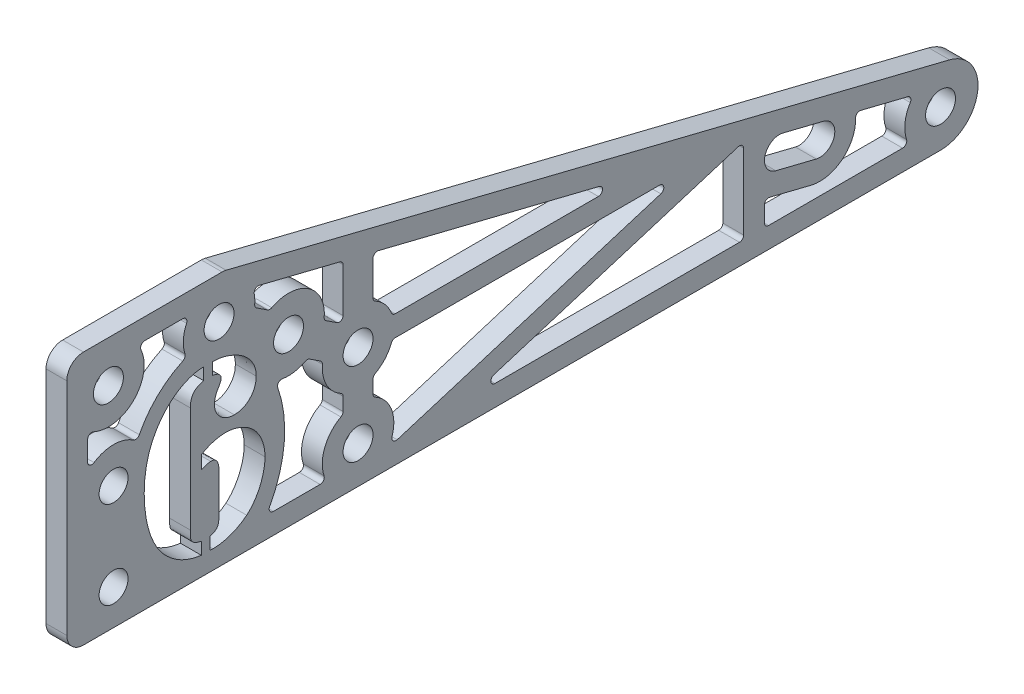
from build123d import *

# Parameters (mm, degrees)
SKETCH1_R           = 2.286
BOSS_EXTRUDE1_DEPTH = 3.175
SKETCH2_R           = 2.20991013
CUT_EXTRUDE1_DEPTH  = 99.353280322
CUT_EXTRUDE2_DEPTH  = 99.353280322
CUT_EXTRUDE3_DEPTH  = 99.353280448


with BuildPart() as part:
    # Sketch1 → Boss-Extrude1 (new body)
    with BuildSketch(Plane(origin=(0, 0, 0), x_dir=(0, 0, -1), z_dir=(1, 0, 0))):
        with BuildLine():
            Line((-20.135783276, 26.595233027), (90.276415546, -0.80322569))
            ThreePointArc((90.276415546, -0.80322569), (94.572787682, -7.043328861), (88.9, -12.065))
            Line((88.9, -12.065), (0, -12.065))
            Line((0, -12.065), (-41.91, -12.065))
            ThreePointArc((-41.91, -12.065), (-43.706051224, -11.321051224), (-44.45, -9.525))
            Line((-44.45, -9.525), (-44.45, 24.13))
            ThreePointArc((-44.45, 24.13), (-43.706051224, 25.926051224), (-41.91, 26.67))
            Line((-41.91, 26.67), (-20.747523518, 26.67))
            ThreePointArc((-20.747523518, 26.67), (-20.439377358, 26.65123897), (-20.135783276, 26.595233027))
        make_face()
        with Locations((0, 6.35)):
            Circle(SKETCH1_R, mode=Mode.SUBTRACT)
        with Locations((0, -6.35)):
            Circle(SKETCH1_R, mode=Mode.SUBTRACT)
        with Locations((88.9, -6.35)):
            Circle(SKETCH1_R, mode=Mode.SUBTRACT)
        with Locations((-21.213182222, 20.32)):
            Circle(SKETCH1_R, mode=Mode.SUBTRACT)
        with Locations((-10.606591111, 13.335)):
            Circle(SKETCH1_R, mode=Mode.SUBTRACT)
        with Locations((-38.1, 20.32)):
            Circle(SKETCH1_R, mode=Mode.SUBTRACT)
    extrude(amount=BOSS_EXTRUDE1_DEPTH)

    # Sketch2 → Cut-Extrude1 (cut, through all)
    with BuildSketch(Plane(origin=(3.175, 0, 0), x_dir=(0, 0, -1), z_dir=(1, 0, 0))):
        with Locations((-37.310316922, 6.68008987)):
            Circle(SKETCH2_R)
        with Locations((-37.310316922, -6.68008987)):
            Circle(SKETCH2_R)
        with BuildLine():
            Line((64.861053538, 2.232227609), (71.024136105, 0.702877002))
            ThreePointArc((71.024136105, 0.702877002), (72.69227961, -2.06639894), (69.923003668, -3.734542446))
            Line((69.923003668, -3.734542446), (63.759921102, -2.205191839))
            ThreePointArc((63.759921102, -2.205191839), (62.091777596, 0.564084103), (64.861053538, 2.232227609))
        make_face()
    extrude(amount=-CUT_EXTRUDE1_DEPTH, mode=Mode.SUBTRACT)

    # Sketch3 → Cut-Extrude2 (cut, through all)
    with BuildSketch(Plane(origin=(3.175, 0, 0), x_dir=(0, 0, -1), z_dir=(1, 0, 0))):
        with BuildLine():
            Line((-23.589615802, 15.538483073), (-23.589615802, 13.731875))
            add(Edge.make_bspline(
                [(-23.589615802, 13.731875), (-23.758611217, 13.678210567), (-24.077268221, 13.577021151), (-24.510457914, 13.372609717), (-24.866181573, 13.126522501), (-25.151110457, 12.837721592), (-25.354073316, 12.490606569), (-25.502400912, 12.09276775), (-25.581902611, 11.629848452), (-25.594035845, 11.302394911), (-25.600449135, 11.129312066)],
                knots=[0, 0, 0, 0, 1.177836724, 2.220923683, 3.170508287, 4.04032801, 4.893978525, 5.822851288, 6.849219673, 8, 8, 8, 8], degree=3))
            Line((-25.600449135, 11.129312066), (-25.600449135, -5.020193142))
            add(Edge.make_bspline(
                [(-25.600449135, -5.020193142), (-25.59897276, -5.149358853), (-25.596258891, -5.386790891), (-25.588810183, -5.711801227), (-25.567152347, -5.972099442), (-25.537820037, -6.230012219), (-25.449384558, -6.504947834), (-25.309832818, -6.67338549), (-25.23912752, -6.758726128)],
                knots=[0, 0, 0, 0, 1.276365713, 2.34621177, 3.211297358, 3.855222149, 4.913326661, 6, 6, 6, 6], degree=3))
            add(Edge.make_bspline(
                [(-25.23912752, -6.758726128), (-25.171800829, -6.821594977), (-25.024733704, -6.958924475), (-24.721460327, -7.103160379), (-24.352153066, -7.239187423), (-24.074133968, -7.304753875), (-23.924754691, -7.339982639)],
                knots=[0, 0, 0, 0, 0.755126351, 1.649483421, 2.737070691, 4, 4, 4, 4], degree=3))
            Line((-23.924754691, -7.339982639), (-23.924754691, -9.183246528))
            add(Edge.make_bspline(
                [(-23.924754691, -9.183246528), (-24.20861298, -9.14360293), (-24.773201696, -9.064752572), (-25.598774489, -8.844828187), (-26.398751498, -8.551400454), (-27.167789719, -8.178215975), (-27.906188104, -7.734157708), (-28.594033228, -7.203257017), (-29.259339008, -6.619494893), (-29.652929701, -6.173321151), (-29.852523788, -5.947061632)],
                knots=[0, 0, 0, 0, 0.993273036, 1.975601091, 2.956248835, 3.944528193, 4.936047062, 5.938575079, 6.95462918, 8, 8, 8, 8], degree=3))
            add(Edge.make_bspline(
                [(-29.852523788, -5.947061632), (-30.069256483, -5.67279978), (-30.512746895, -5.111590033), (-31.054763097, -4.150748384), (-31.534073768, -3.092681218), (-31.93102009, -1.934647008), (-32.249773275, -0.69878543), (-32.470897497, 0.597556869), (-32.61170248, 1.944796815), (-32.62936761, 2.860448778), (-32.638365802, 3.326859809)],
                knots=[0, 0, 0, 0, 0.848908429, 1.737083309, 2.673598995, 3.670958022, 4.709700774, 5.773871062, 6.866063596, 8, 8, 8, 8], degree=3))
            add(Edge.make_bspline(
                [(-32.638365802, 3.326859809), (-32.629900781, 3.819654234), (-32.613368719, 4.782074492), (-32.438217751, 6.184473628), (-32.173057733, 7.511860963), (-31.781506652, 8.757362566), (-31.290588656, 9.92839073), (-30.683537396, 11.017543636), (-29.972539678, 12.034325829), (-29.411286157, 12.638320966), (-29.129880559, 12.941156684)],
                knots=[0, 0, 0, 0, 1.125083173, 2.197270879, 3.223201206, 4.213147336, 5.174373174, 6.118528402, 7.056653326, 8, 8, 8, 8], degree=3))
            add(Edge.make_bspline(
                [(-29.129880559, 12.941156684), (-28.923522589, 13.138379357), (-28.514878057, 13.528933534), (-27.856869622, 14.045877655), (-27.1679376, 14.489483791), (-26.461526617, 14.865931187), (-25.74070814, 15.164377648), (-25.020572226, 15.382401884), (-24.303085763, 15.513339719), (-23.825771706, 15.530160716), (-23.589615802, 15.538483073)],
                knots=[0, 0, 0, 0, 1.091574889, 2.161613191, 3.195169959, 4.222755612, 5.219792993, 6.174728054, 7.096928445, 8, 8, 8, 8], degree=3))
        make_face()
        with BuildLine():
            Line((-22.249060246, 13.731875), (-22.249060246, 15.538483073))
            add(Edge.make_bspline(
                [(-22.249060246, 15.538483073), (-21.958611237, 15.528190342), (-21.371823435, 15.507396161), (-20.491326381, 15.342204867), (-19.605727748, 15.075886043), (-19.03307501, 14.820572175), (-18.740575003, 14.69016276)],
                knots=[0, 0, 0, 0, 0.957329974, 1.934072875, 2.94476415, 4, 4, 4, 4], degree=3))
            add(Edge.make_bspline(
                [(-18.740575003, 14.69016276), (-18.499727092, 14.566877129), (-18.030125122, 14.326496489), (-17.399246085, 13.875561165), (-16.848097114, 13.376606015), (-16.385587604, 12.824526495), (-16.012535651, 12.235566859), (-15.739299699, 11.615573945), (-15.576451216, 10.968332184), (-15.556358962, 10.528004041), (-15.546282468, 10.307174479)],
                knots=[0, 0, 0, 0, 1.133386976, 2.209862454, 3.240979251, 4.243853893, 5.220771738, 6.155072333, 7.074747837, 8, 8, 8, 8], degree=3))
            add(Edge.make_bspline(
                [(-15.546282468, 10.307174479), (-15.556183913, 10.072033158), (-15.575483224, 9.613709584), (-15.760850092, 8.956549975), (-16.062664507, 8.358406096), (-16.484858127, 7.838191883), (-16.987060026, 7.401782627), (-17.565347341, 7.085991083), (-18.205127211, 6.895631426), (-18.6519747, 6.87311613), (-18.881961722, 6.861527778)],
                knots=[0, 0, 0, 0, 1.052335015, 2.051149251, 3.034759759, 4.037094461, 5.036307284, 5.99952726, 6.970380773, 8, 8, 8, 8], degree=3))
            add(Edge.make_bspline(
                [(-18.881961722, 6.861527778), (-19.085466954, 6.871101845), (-19.483206384, 6.889813817), (-20.056587319, 7.051770226), (-20.576601884, 7.325803066), (-21.040897366, 7.690553948), (-21.426022305, 8.13068552), (-21.71081816, 8.624395384), (-21.880685677, 9.165265807), (-21.902676557, 9.539694445), (-21.913921357, 9.731154514)],
                knots=[0, 0, 0, 0, 1.052177608, 2.056421433, 3.054792914, 4.078048738, 5.096504648, 6.06384139, 7.009966053, 8, 8, 8, 8], degree=3))
            add(Edge.make_bspline(
                [(-21.913921357, 9.731154514), (-21.906173102, 9.887034957), (-21.890423111, 10.203895404), (-21.78189824, 10.677098545), (-21.601743183, 11.148526773), (-21.434361284, 11.447178752), (-21.348374482, 11.600601128)],
                knots=[0, 0, 0, 0, 0.946230724, 1.923416974, 2.933225545, 4, 4, 4, 4], degree=3))
            add(Edge.make_bspline(
                [(-21.348374482, 11.600601128), (-21.272899755, 11.723323451), (-21.144635911, 11.931881167), (-21.00001835, 12.221103032), (-20.91812096, 12.470242246), (-20.911739336, 12.629849013), (-20.908504691, 12.710748698)],
                knots=[0, 0, 0, 0, 1.426676034, 2.424532782, 3.201444875, 4, 4, 4, 4], degree=3))
            add(Edge.make_bspline(
                [(-20.908504691, 12.710748698), (-20.911962205, 12.777691979), (-20.9185971, 12.906154662), (-20.986578239, 13.087672304), (-21.0949877, 13.247671479), (-21.2429992, 13.391611027), (-21.439232689, 13.504927581), (-21.670688359, 13.6049014), (-21.945489641, 13.682535559), (-22.143917264, 13.714786073), (-22.249060246, 13.731875)],
                knots=[0, 0, 0, 0, 0.864688311, 1.659317839, 2.475251474, 3.355494564, 4.310252246, 5.394837407, 6.619574429, 8, 8, 8, 8], degree=3))
        make_face()
        with BuildLine():
            Line((-23.924754691, 2.096271701), (-23.924754691, 4.128051215))
            add(Edge.make_bspline(
                [(-23.924754691, 4.128051215), (-23.611993637, 4.288644431), (-23.005279164, 4.600173719), (-22.068297393, 4.939399794), (-21.142357795, 5.141819674), (-20.52890992, 5.171340742), (-20.227753823, 5.185833333)],
                knots=[0, 0, 0, 0, 1.085282539, 2.105302489, 3.069848097, 4, 4, 4, 4], degree=3))
            add(Edge.make_bspline(
                [(-20.227753823, 5.185833333), (-20.045976446, 5.180616683), (-19.680752598, 5.170135483), (-19.132838819, 5.08997605), (-18.587802745, 4.950125897), (-18.045666301, 4.769332486), (-17.51945578, 4.540576777), (-17.022660672, 4.267683704), (-16.555395933, 3.958973089), (-16.273623878, 3.719076418), (-16.132775524, 3.599160156)],
                knots=[0, 0, 0, 0, 0.972589152, 1.954108701, 2.955474046, 3.980479148, 5.009562198, 6.021200449, 7.010864794, 8, 8, 8, 8], degree=3))
            add(Edge.make_bspline(
                [(-16.132775524, 3.599160156), (-15.986255799, 3.45388015), (-15.692086279, 3.162199628), (-15.309952266, 2.665629046), (-14.979809233, 2.124188838), (-14.702315848, 1.543373871), (-14.485347672, 0.931796902), (-14.318239778, 0.29877731), (-14.224099622, -0.356816424), (-14.211880783, -0.801001), (-14.205726913, -1.024709201)],
                knots=[0, 0, 0, 0, 0.960654025, 1.928717332, 2.91079185, 3.911286876, 4.922404946, 5.930508659, 6.95772566, 8, 8, 8, 8], degree=3))
            add(Edge.make_bspline(
                [(-14.205726913, -1.024709201), (-14.214279835, -1.323818372), (-14.231389035, -1.922154), (-14.386800472, -2.813408619), (-14.628113333, -3.697371486), (-14.960582648, -4.56173919), (-15.367381343, -5.38030512), (-15.842678252, -6.127689067), (-16.378137878, -6.793820747), (-16.792746845, -7.170367015), (-16.996805472, -7.355692274)],
                knots=[0, 0, 0, 0, 1.007304958, 2.015004901, 3.039646456, 4.091698815, 5.130844098, 6.114845671, 7.072181175, 8, 8, 8, 8], degree=3))
            add(Edge.make_bspline(
                [(-16.996805472, -7.355692274), (-17.174289288, -7.493320553), (-17.532152374, -7.770822365), (-18.119821248, -8.133479819), (-18.753765471, -8.450260967), (-19.421395587, -8.72662389), (-20.109086023, -8.943070202), (-20.794027297, -9.108810927), (-21.474723631, -9.206274677), (-21.925845957, -9.218885131), (-22.149565888, -9.225138889)],
                knots=[0, 0, 0, 0, 0.965288144, 1.946323901, 2.963451572, 4.010279453, 5.050032815, 6.060491454, 7.038161726, 8, 8, 8, 8], degree=3))
            Line((-22.149565888, -9.225138889), (-22.584199135, -9.183246528))
            Line((-22.584199135, -9.183246528), (-22.584199135, -7.339982639))
            add(Edge.make_bspline(
                [(-22.584199135, -7.339982639), (-22.471160477, -7.310511332), (-22.257366348, -7.254771175), (-21.973185726, -7.118956595), (-21.73158392, -6.972192729), (-21.544924515, -6.784763798), (-21.403177296, -6.562315449), (-21.312961612, -6.294740827), (-21.254828208, -5.987967628), (-21.247509927, -5.769326315), (-21.243643579, -5.653815104)],
                knots=[0, 0, 0, 0, 1.174511043, 2.221395497, 3.163228448, 4.009149245, 4.86326273, 5.798169132, 6.836742493, 8, 8, 8, 8], degree=3))
            Line((-21.243643579, -5.653815104), (-21.243643579, 0.92328559))
            add(Edge.make_bspline(
                [(-21.243643579, 0.92328559), (-21.247262638, 1.042267849), (-21.254132603, 1.268128803), (-21.316414991, 1.589093989), (-21.425957035, 1.87013373), (-21.578925155, 2.107408533), (-21.761677675, 2.299720834), (-21.977730216, 2.437990936), (-22.225756199, 2.506681358), (-22.397082118, 2.505385152), (-22.484704777, 2.504722222)],
                knots=[0, 0, 0, 0, 1.252532866, 2.377650834, 3.425917608, 4.410309965, 5.333554112, 6.20090564, 7.079874001, 8, 8, 8, 8], degree=3))
            add(Edge.make_bspline(
                [(-22.484704777, 2.504722222), (-22.584584274, 2.496788189), (-22.800712622, 2.479619806), (-23.141990437, 2.394048239), (-23.523965993, 2.269221491), (-23.785975974, 2.156157996), (-23.924754691, 2.096271701)],
                knots=[0, 0, 0, 0, 0.797685093, 1.726103611, 2.795586252, 4, 4, 4, 4], degree=3))
        make_face()
    extrude(amount=-CUT_EXTRUDE2_DEPTH, mode=Mode.SUBTRACT)

    # Sketch4 → Cut-Extrude3 (cut, through all)
    with BuildSketch(Plane(origin=(3.175, 0, 0), x_dir=(0, 0, -1), z_dir=(1, 0, 0))):
        with BuildLine():
            Line((-7.395254847, 8.482980792), (-5.725936264, 7.383646408))
            ThreePointArc((-5.725936264, 7.383646408), (-5.50420198, 7.131169237), (-5.442354362, 6.800888014))
            ThreePointArc((-5.442354362, 6.800888014), (-4.807541344, 3.759620255), (-2.616729167, 1.556749593))
            ThreePointArc((-2.616729167, 1.556749593), (-2.374906153, 1.323441975), (-2.286, 0.999394894))
            Line((-2.286, 0.999394894), (-2.286, -0.999394894))
            ThreePointArc((-2.286, -0.999394894), (-2.374906153, -1.323441975), (-2.616729167, -1.556749593))
            ThreePointArc((-2.616729167, -1.556749593), (-5.078227411, -4.341486279), (-5.187500885, -8.0565625))
            ThreePointArc((-5.187500885, -8.0565625), (-5.27628987, -8.627301751), (-5.790698663, -8.89))
            Line((-5.790698663, -8.89), (-12.929495376, -8.89))
            ThreePointArc((-12.929495376, -8.89), (-13.476004182, -8.578346756), (-13.486068131, -7.94930118))
            ThreePointArc((-13.486068131, -7.94930118), (-11.260455775, -0.547496608), (-12.249253468, 7.118163209))
            ThreePointArc((-12.249253468, 7.118163209), (-12.135056425, 7.73915143), (-11.541562492, 7.954632957))
            ThreePointArc((-11.541562492, 7.954632957), (-9.745530476, 7.942310914), (-8.042638833, 8.513312566))
            ThreePointArc((-8.042638833, 8.513312566), (-7.714785899, 8.586955409), (-7.395254847, 8.482980792))
        make_face()
        with BuildLine():
            Line((2.286, -0.999394894), (2.286, 0.999394894))
            ThreePointArc((2.286, 0.999394894), (2.374906153, 1.323441975), (2.616729167, 1.556749593))
            ThreePointArc((2.616729167, 1.556749593), (4.097901931, 2.740329549), (5.085123546, 4.359010417))
            ThreePointArc((5.085123546, 4.359010417), (5.318495283, 4.652016022), (5.676416982, 4.7625))
            Line((5.676416982, 4.7625), (46.027287975, 4.7625))
            ThreePointArc((46.027287975, 4.7625), (46.655226498, 4.221936284), (46.214060198, 3.520588856))
            Line((46.214060198, 3.520588856), (5.977470886, -8.861911144))
            ThreePointArc((5.977470886, -8.861911144), (5.3373785, -8.699663727), (5.187500885, -8.0565625))
            ThreePointArc((5.187500885, -8.0565625), (5.078227411, -4.341486279), (2.616729167, -1.556749593))
            ThreePointArc((2.616729167, -1.556749593), (2.374906153, -1.323441975), (2.286, -0.999394894))
        make_face()
        with BuildLine():
            Line((2.286, 11.700605106), (2.286, 16.948209017))
            ThreePointArc((2.286, 16.948209017), (2.529776767, 17.44837837), (3.073935061, 17.564517273))
            Line((3.073935061, 17.564517273), (36.826944994, 9.188808257))
            ThreePointArc((36.826944994, 9.188808257), (37.304319676, 8.49546346), (36.674009934, 7.9375))
            Line((36.674009934, 7.9375), (5.676416982, 7.9375))
            ThreePointArc((5.676416982, 7.9375), (5.318495283, 8.047983978), (5.085123546, 8.340989583))
            ThreePointArc((5.085123546, 8.340989583), (4.097901931, 9.959670451), (2.616729167, 11.143250407))
            ThreePointArc((2.616729167, 11.143250407), (2.374906153, 11.376558025), (2.286, 11.700605106))
        make_face()
        with BuildLine():
            Line((-2.286, 11.667298149), (-2.286, 18.39788394))
            ThreePointArc((-2.286, 18.39788394), (-2.420830647, 18.789107173), (-2.768064939, 19.014192196))
            Line((-2.768064939, 19.014192196), (-15.070003442, 22.066881644))
            ThreePointArc((-15.070003442, 22.066881644), (-15.659044821, 21.912131921), (-15.846922224, 21.332805326))
            ThreePointArc((-15.846922224, 21.332805326), (-15.759547137, 20.603523111), (-15.770827861, 19.869111986))
            ThreePointArc((-15.770827861, 19.869111986), (-15.708980242, 19.538830763), (-15.487245958, 19.286353592))
            Line((-15.487245958, 19.286353592), (-13.817927375, 18.187019208))
            ThreePointArc((-13.817927375, 18.187019208), (-13.498396323, 18.083044591), (-13.17054339, 18.156687434))
            ThreePointArc((-13.17054339, 18.156687434), (-7.603041111, 17.895834178), (-5.164236749, 12.884111986))
            ThreePointArc((-5.164236749, 12.884111986), (-5.102389131, 12.553830763), (-4.880654847, 12.301353592))
            Line((-4.880654847, 12.301353592), (-3.183519471, 11.183700382))
            ThreePointArc((-3.183519471, 11.183700382), (-2.590379745, 11.157541344), (-2.286, 11.667298149))
        make_face()
        with BuildLine():
            Line((-41.275, 14.778374246), (-41.275, 11.786402297))
            ThreePointArc((-41.275, 11.786402297), (-40.942473419, 11.22807011), (-40.293158013, 11.254494753))
            ThreePointArc((-40.293158013, 11.254494753), (-37.293975699, 12.141065421), (-34.300152931, 11.236561504))
            ThreePointArc((-34.300152931, 11.236561504), (-33.788168643, 11.152386826), (-33.38432048, 11.478147397))
            ThreePointArc((-33.38432048, 11.478147397), (-30.603831729, 15.240908282), (-26.752820052, 17.897823078))
            ThreePointArc((-26.752820052, 17.897823078), (-26.440706757, 18.218346448), (-26.417401073, 18.665120199))
            ThreePointArc((-26.417401073, 18.665120199), (-26.664042063, 20.652637941), (-26.177555294, 22.595416667))
            ThreePointArc((-26.177555294, 22.595416667), (-26.22037584, 23.202939195), (-26.754807977, 23.495))
            Line((-26.754807977, 23.495), (-32.558374246, 23.495))
            ThreePointArc((-32.558374246, 23.495), (-33.092806382, 23.202939195), (-33.135626928, 22.595416667))
            ThreePointArc((-33.135626928, 22.595416667), (-34.238489868, 16.458489868), (-40.375416667, 15.355626928))
            ThreePointArc((-40.375416667, 15.355626928), (-40.982939195, 15.312806382), (-41.275, 14.778374246))
        make_face()
        with BuildLine():
            Line((62.02448732, -5.857674292), (62.02448732, -8.255))
            ThreePointArc((62.02448732, -8.255), (62.210474514, -8.704012806), (62.65948732, -8.89))
            Line((62.65948732, -8.89), (83.109301337, -8.89))
            ThreePointArc((83.109301337, -8.89), (83.62371013, -8.627301751), (83.712499115, -8.0565625))
            ThreePointArc((83.712499115, -8.0565625), (83.479336215, -5.687485755), (84.276210414, -3.44430028))
            ThreePointArc((84.276210414, -3.44430028), (84.327493339, -2.868977034), (83.891495522, -2.490119963))
            Line((83.891495522, -2.490119963), (76.719571388, -0.710428322))
            ThreePointArc((76.719571388, -0.710428322), (76.167701676, -0.832695949), (75.931941906, -1.346434094))
            ThreePointArc((75.931941906, -1.346434094), (73.904407884, -5.764582142), (69.158328365, -6.816083729))
            Line((69.158328365, -6.816083729), (62.812422381, -5.241366035))
            ThreePointArc((62.812422381, -5.241366035), (62.268264087, -5.357504939), (62.02448732, -5.857674292))
        make_face()
        with BuildLine():
            Line((20.903090386, -8.89), (58.21448732, -8.89))
            ThreePointArc((58.21448732, -8.89), (58.663500126, -8.704012806), (58.84948732, -8.255))
            Line((58.84948732, -8.255), (58.84948732, 3.227294609))
            ThreePointArc((58.84948732, 3.227294609), (58.59173037, 3.738090733), (58.027715097, 3.834205753))
            Line((58.027715097, 3.834205753), (20.716318163, -7.648088856))
            ThreePointArc((20.716318163, -7.648088856), (20.275151863, -8.349436284), (20.903090386, -8.89))
        make_face()
    extrude(amount=-CUT_EXTRUDE3_DEPTH, mode=Mode.SUBTRACT)


solid = part.part
